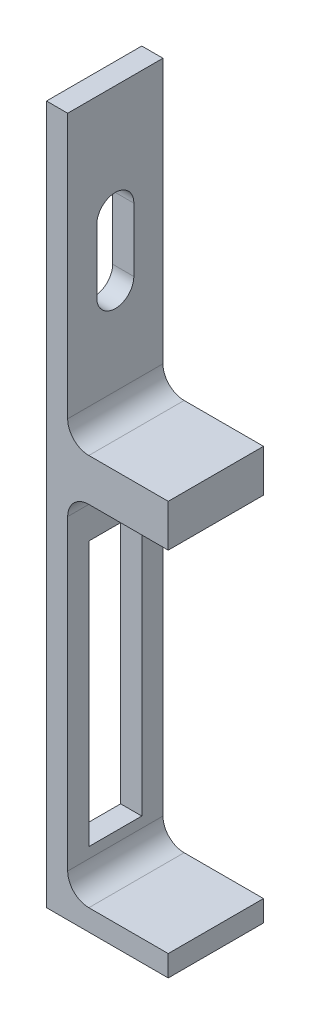
from build123d import *

# Parameters (mm, degrees)
EXTRUDE_1_DEPTH     = 9
CUT_EXTRUDE_2_DEPTH = 68.596227705
SKETCH_6_W          = 5
SKETCH_6_H          = 25
CUT_EXTRUDE_3_DEPTH = 68.284842275
FILLET_1_R          = 2
SKETCH_7_W          = 9.5
SKETCH_7_H          = 4
EXTRUDE_2_DEPTH     = 9
FILLET_2_R          = 2


with BuildPart() as part:
    # Эскиз1 → Бобышка-Вытянуть1 (new body)
    with BuildSketch(Plane.XY):
        Polygon((0, 0), (11.5, 0), (11.5, 2), (2, 2), (2, 66), (0, 66), align=None)
    extrude(amount=EXTRUDE_1_DEPTH)

    # Эскиз4 → Вырез-Вытянуть2 (cut, through all)
    with BuildSketch(Plane.ZY):
        with BuildLine():
            Line((6.25, 55.52), (6.25, 49.52))
            ThreePointArc((6.25, 49.52), (4.5, 47.77), (2.75, 49.52))
            Line((2.75, 49.52), (2.75, 55.52))
            ThreePointArc((2.75, 55.52), (4.5, 57.27), (6.25, 55.52))
        make_face()
    extrude(amount=-CUT_EXTRUDE_2_DEPTH, mode=Mode.SUBTRACT)

    # Эскиз6 → Вырез-Вытянуть3 (cut, through all)
    with BuildSketch(Plane(origin=(2, 0, 0), x_dir=(0, 0, -1), z_dir=(1, 0, 0))):
        with Locations((-4.5, 17.5)):
            Rectangle(SKETCH_6_W, SKETCH_6_H)
    extrude(amount=-CUT_EXTRUDE_3_DEPTH, mode=Mode.SUBTRACT)

    # Скругление1
    fillet_1_edges = [part.edges().sort_by_distance(p)[0] for p in [
        (2, 2, 4.5),
    ]]
    fillet(fillet_1_edges, radius=FILLET_1_R)

    # Эскиз7 → Бобышка-Вытянуть2 (add)
    with BuildSketch(Plane.XY.offset(9)):
        with Locations((6.75, 37)):
            Rectangle(SKETCH_7_W, SKETCH_7_H)
    extrude(amount=-EXTRUDE_2_DEPTH)

    # Скругление2
    fillet_2_edges = [part.edges().sort_by_distance(p)[0] for p in [
        (2, 39, 4.5),
        (2, 35, 4.5),
    ]]
    fillet(fillet_2_edges, radius=FILLET_2_R)


solid = part.part
